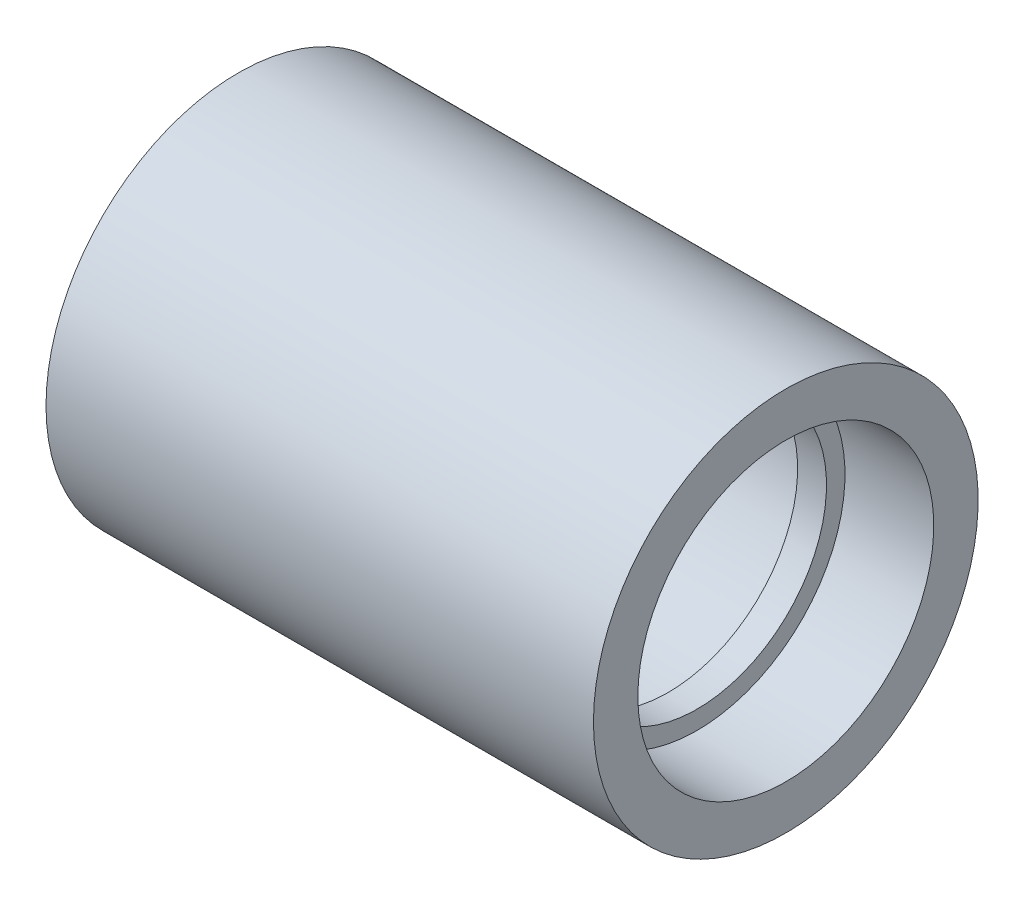
from build123d import *


with BuildPart() as part:
    # Sketch1 → Revolve1 (revolve)
    with BuildSketch(Plane.XY, mode=Mode.PRIVATE) as revolve1_sk:
        Polygon((12.337440982, 22), (12.337440982, 23.5), (-1.662559018, 23.5), (-1.662559018, 26), (72.337440982, 26), (72.337440982, 20), (60.337440982, 20), (60.337440982, 17.5), (56.437440982, 17.5), (56.437440982, 22), align=None)
    revolve(revolve1_sk.sketch.rotate(Axis((0, 0, 0), (1, 0, 0)), 90), axis=Axis((0, 0, 0), (1, 0, 0)))


solid = part.part
